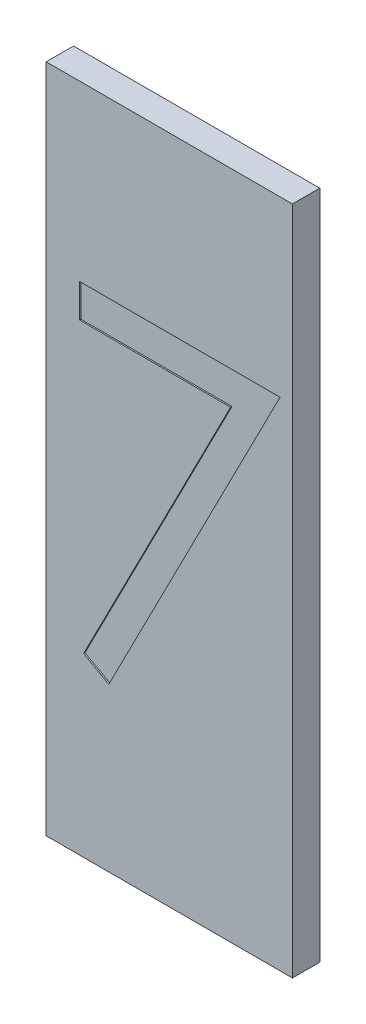
from build123d import *

# Parameters (mm, degrees)
SKETCH_1_W          = 18
SKETCH_1_H          = 49
EXTRUDE_1_DEPTH     = 2
CUT_EXTRUDE_1_DEPTH = 0.1


with BuildPart() as part:
    # ｽｹｯﾁ1 → ﾎﾞｽ - 押し出し1 (new body)
    with BuildSketch(Plane.XY):
        with Locations((9, 24.5)):
            Rectangle(SKETCH_1_W, SKETCH_1_H)
    extrude(amount=EXTRUDE_1_DEPTH)

    # ｽｹｯﾁ2 → ｶｯﾄ - 押し出し1 (cut)
    with BuildSketch(Plane.XY.offset(2)):
        Polygon((2.442307692, 36.3125), (17.096153846, 36.3125), (4.579326923, 11.889423077), (2.733285757, 12.905461238), (13.48039363, 33.870192308), (2.442307692, 33.870192308), align=None)
    extrude(amount=-CUT_EXTRUDE_1_DEPTH, mode=Mode.SUBTRACT)


solid = part.part
